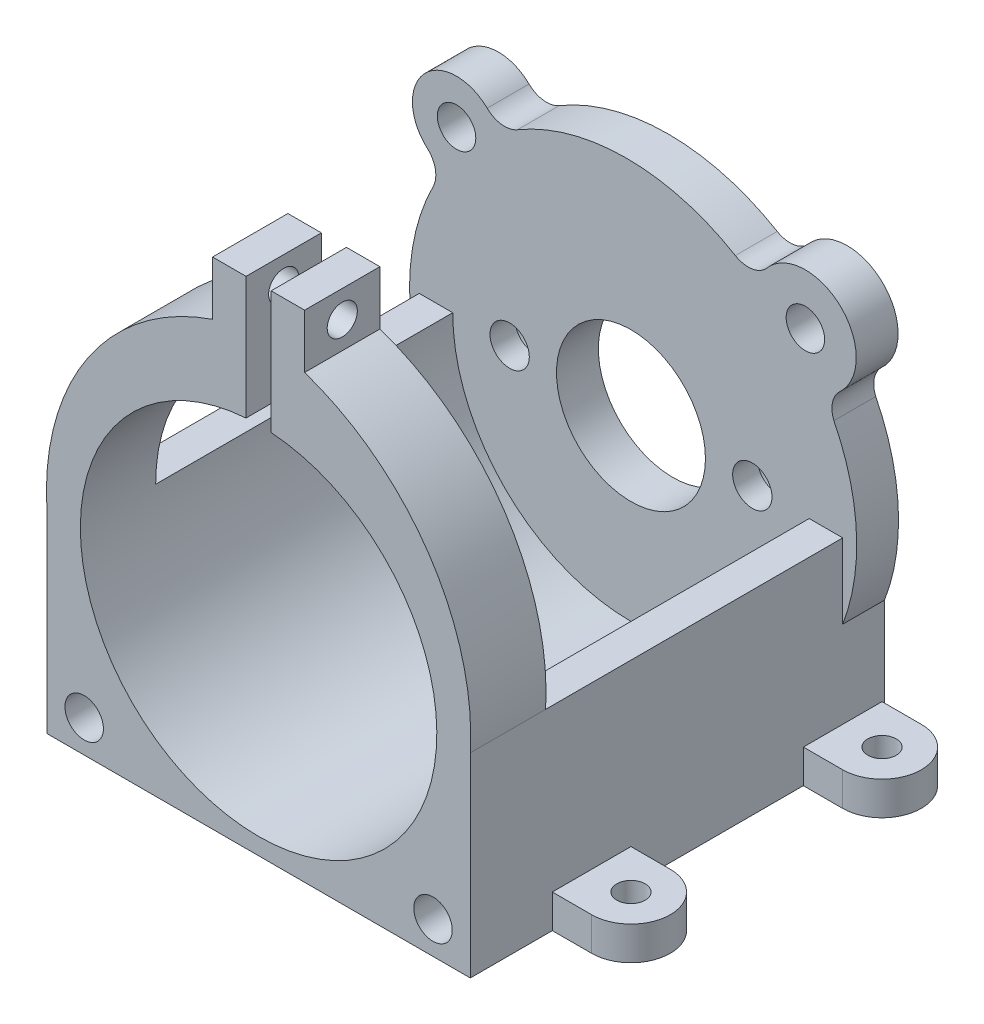
from build123d import *
from build123d.topology import SkipClean

# Parameters (mm, degrees)
SKETCH_1_R               = 2.35
SKETCH_1_R_2             = 8.9
EXTRUDE_1_DEPTH          = 5
EXTRUDE_2_DEPTH          = 44.5
EXTRUDE_2_DEPTH_BACK     = 5
EXTRUDE_START            = -9
EXTRUDE_3_DEPTH          = 9
SKETCH_5_R               = 1.8
CUT_EXTRUDE_2_DEPTH      = 19
CUT_EXTRUDE_5_DEPTH      = 10
CUT_EXTRUDE_5_DEPTH_BACK = 10
SKETCH_9_W               = 118.709111843
SKETCH_9_H               = 68.105929764
SKETCH_9_W_2             = 50.6
SKETCH_9_H_2             = 49.5
SKETCH_10_W              = 50.6
SKETCH_10_H              = 4.95
CUT_EXTRUDE_6_DEPTH      = 67.841008738
SKETCH_11_R              = 2.3
CUT_EXTRUDE_7_DEPTH      = 67.841008738
SKETCH_12_R              = 2.3
CUT_EXTRUDE_8_DEPTH      = 10
SKETCH_13_R              = 4.5
CUT_EXTRUDE_9_DEPTH      = 2
SKETCH_14_R              = 1.7
EXTRUDE_4_DEPTH          = 4


with BuildPart() as part:
    # Эскиз1 → Бобышка-Вытянуть1 (new body)
    with BuildSketch(Plane.XY):
        with BuildLine():
            ThreePointArc((-13.750457514, -22.60807726), (-15.630598029, -22.207924557), (-17.367665677, -23.031117444))
            ThreePointArc((-17.367665677, -23.031117444), (-24.500349004, -22.846945062), (-24.186521915, -15.718789377))
            ThreePointArc((-24.186521915, -15.718789377), (-23.24416257, -14.043376172), (-23.512188549, -12.139902343))
            ThreePointArc((-23.512188549, -12.139902343), (-26.460924905, -0.14032965), (-23.639624978, 11.889843151))
            ThreePointArc((-23.639624978, 11.889843151), (-23.371598999, 13.79331698), (-24.313958344, 15.468730186))
            ThreePointArc((-24.313958344, 15.468730186), (-24.723627875, 23.005643376), (-17.178817704, 23.226389957))
            ThreePointArc((-17.178817704, 23.226389957), (-15.441750056, 22.403197069), (-13.561609541, 22.803349773))
            ThreePointArc((-13.561609541, 22.803349773), (-0.542505729, 26.377270873), (12.476598084, 22.803349773))
            ThreePointArc((12.476598084, 22.803349773), (14.356738599, 22.403197069), (16.093806247, 23.226389957))
            ThreePointArc((16.093806247, 23.226389957), (25.011719512, 23.858129918), (24.906055495, 14.918493041))
            ThreePointArc((24.906055495, 14.918493041), (24.067269609, 13.359986921), (24.253003064, 11.599871535))
            ThreePointArc((24.253003064, 11.599871535), (26.972168217, 0.141967553), (24.253003064, -11.31593643))
            ThreePointArc((24.253003064, -11.31593643), (23.984977085, -13.219410259), (24.92733643, -14.894823465))
            ThreePointArc((24.92733643, -14.894823465), (24.934120683, -23.972974271), (15.904958274, -23.031117444))
            ThreePointArc((15.904958274, -23.031117444), (14.167890626, -22.207924557), (12.287750111, -22.60807726))
            ThreePointArc((12.287750111, -22.60807726), (-0.731353702, -26.18199836), (-13.750457514, -22.60807726))
        make_face()
        with Locations((-14.5, 0)):
            Circle(SKETCH_1_R, mode=Mode.SUBTRACT)
        with Locations((14.5, 0)):
            Circle(SKETCH_1_R, mode=Mode.SUBTRACT)
        Circle(SKETCH_1_R_2, mode=Mode.SUBTRACT)
    extrude(amount=EXTRUDE_1_DEPTH)

    # Эскиз2 → Бобышка-Вытянуть2 (add, two sides: drawn at the far end of the back side and taken through both)
    with BuildSketch(Plane.XY.offset(5).offset(-EXTRUDE_2_DEPTH_BACK)):
        with BuildLine():
            Line((-25.3, 0), (-21.3, 0))
            ThreePointArc((-21.3, 0), (0, -21.3), (21.3, 0))
            Line((21.3, 0), (25.3, 0))
            Line((25.3, 0), (25.3, -13.25))
            ThreePointArc((25.3, -13.25), (28.228932188, -20.321067812), (35.3, -23.25))
            Line((35.3, -23.25), (50, -23.25))
            Line((50, -23.25), (50, -28.25))
            Line((50, -28.25), (-50, -28.25))
            Line((-50, -28.25), (-50, -23.25))
            Line((-50, -23.25), (-35.3, -23.25))
            ThreePointArc((-35.3, -23.25), (-28.228932188, -20.321067812), (-25.3, -13.25))
            Line((-25.3, -13.25), (-25.3, 0))
        make_face()
    extrude(amount=EXTRUDE_2_DEPTH + EXTRUDE_2_DEPTH_BACK)

    # Эскиз4 → Бобышка-Вытянуть3 (add)
    with SkipClean():  # the faces are left unmerged after this step: merging them gives an invalid solid
        with BuildSketch(Plane.XY.offset(49.5).offset(EXTRUDE_START)):
            with BuildLine():
                Line((21.3, 0), (25.3, 0))
                ThreePointArc((25.3, 0), (20.373090978, 18.07450089), (5.5, 29.465426213))
                Line((5.5, 29.465426213), (5.5, 35.916188423))
                Line((5.5, 35.916188423), (1.5, 35.916188423))
                Line((1.5, 35.916188423), (1.5, 29.916188423))
                Line((1.5, 29.916188423), (1.5, 21.247117452))
                ThreePointArc((1.5, 21.247117452), (15.582682696, 14.521363572), (21.3, 0))
            make_face()
            with BuildLine():
                Line((-25.3, 0), (-21.3, 0))
                ThreePointArc((-21.3, 0), (-15.582682696, 14.521363572), (-1.5, 21.247117452))
                Line((-1.5, 21.247117452), (-1.5, 29.916188423))
                Line((-1.5, 29.916188423), (-1.5, 35.916188423))
                Line((-1.5, 35.916188423), (-5.5, 35.916188423))
                Line((-5.5, 35.916188423), (-5.5, 29.465426213))
                ThreePointArc((-5.5, 29.465426213), (-20.373090978, 18.07450089), (-25.3, 0))
            make_face()
        extrude(amount=EXTRUDE_3_DEPTH)

    # Эскиз5 → Вырез-Вытянуть2 (cut)
    with SkipClean():  # the faces are left unmerged after this step: merging them gives an invalid solid
        with BuildSketch(Plane.ZY.offset(5.5)):
            with Locations((45, 32.690807318)):
                Circle(SKETCH_5_R)
        extrude(amount=-CUT_EXTRUDE_2_DEPTH, mode=Mode.SUBTRACT)

    # Эскиз9 → Вырез-Вытянуть5 (cut, two sides: drawn at the far end of the back side and taken through both)
    with SkipClean():  # the faces are left unmerged after this step: merging them gives an invalid solid
        with BuildSketch(Plane(origin=(0, -23.25, 0), x_dir=(1, 0, 0), z_dir=(0, 1, 0)).offset(-CUT_EXTRUDE_5_DEPTH_BACK)):
            with Locations((-0.535798399, -23.678403203)):
                Rectangle(SKETCH_9_W, SKETCH_9_H)
            with Locations((0, -24.75)):
                Rectangle(SKETCH_9_W_2, SKETCH_9_H_2, mode=Mode.SUBTRACT)
        extrude(amount=CUT_EXTRUDE_5_DEPTH + CUT_EXTRUDE_5_DEPTH_BACK, mode=Mode.SUBTRACT)

    # Эскиз10 → Вырез-Вытянуть6 (cut, through all)
    with SkipClean():  # the faces are left unmerged after this step: merging them gives an invalid solid
        with BuildSketch(Plane.XY.offset(49.5)):
            with Locations((0, -25.775)):
                Rectangle(SKETCH_10_W, SKETCH_10_H)
        extrude(amount=-CUT_EXTRUDE_6_DEPTH, mode=Mode.SUBTRACT)

    # Эскиз11 → Вырез-Вытянуть7 (cut, through all)
    with SkipClean():  # the faces are left unmerged after this step: merging them gives an invalid solid
        with BuildSketch(Plane(origin=(0, 0, 0), x_dir=(-1, 0, 0), z_dir=(0, 0, -1))):
            with Locations((-20.843580496, -19.436953262)):
                Circle(SKETCH_11_R)
            with Locations((20.843580496, -19.436953262)):
                Circle(SKETCH_11_R)
        extrude(amount=-CUT_EXTRUDE_7_DEPTH, mode=Mode.SUBTRACT)

    # Эскиз12 → Вырез-Вытянуть8 (cut)
    with SkipClean():  # the faces are left unmerged after this step: merging them gives an invalid solid
        with BuildSketch(Plane(origin=(0, 0, 0), x_dir=(-1, 0, 0), z_dir=(0, 0, -1))):
            with Locations((-20.843580496, 19.436953262)):
                Circle(SKETCH_12_R)
            with Locations((20.843580496, 19.436953262)):
                Circle(SKETCH_12_R)
        extrude(amount=-CUT_EXTRUDE_8_DEPTH, mode=Mode.SUBTRACT)

    # Эскиз13 → Вырез-Вытянуть9 (cut)
    with SkipClean():  # the faces are left unmerged after this step: merging them gives an invalid solid
        with BuildSketch(Plane(origin=(0, 0, 0), x_dir=(-1, 0, 0), z_dir=(0, 0, -1))):
            with Locations((-14.5, 0)):
                Circle(SKETCH_13_R)
            with Locations((14.5, 0)):
                Circle(SKETCH_13_R)
        extrude(amount=-CUT_EXTRUDE_9_DEPTH, mode=Mode.SUBTRACT)

    # Эскиз14 → Бобышка-Вытянуть4 (add)
    # profile 1 of 4: a face of its own
    with SkipClean():  # the faces are left unmerged after this step: merging them gives an invalid solid
        with BuildSketch(Plane.XZ.offset(23.3)):
            with BuildLine():
                Line((-30, 39.7), (-25.3, 39.7))
                Line((-25.3, 39.7), (-25.3, 30.3))
                Line((-25.3, 30.3), (-30, 30.3))
                ThreePointArc((-30, 30.3), (-34.7, 35), (-30, 39.7))
            make_face()
            with Locations((-30, 35)):
                Circle(SKETCH_14_R, mode=Mode.SUBTRACT)
        # profile 2 of 4: a face of its own
        with BuildSketch(Plane.XZ.offset(23.3)):
            with BuildLine():
                Line((25.3, 39.7), (25.3, 30.3))
                Line((25.3, 30.3), (30, 30.3))
                ThreePointArc((30, 30.3), (34.7, 35), (30, 39.7))
                Line((30, 39.7), (25.3, 39.7))
            make_face()
            with Locations((30, 35)):
                Circle(SKETCH_14_R, mode=Mode.SUBTRACT)
        # profile 3 of 4: a face of its own
        with BuildSketch(Plane.XZ.offset(23.3)):
            with BuildLine():
                Line((30, 0.3), (25.3, 0.3))
                Line((25.3, 0.3), (25.3, 9.7))
                Line((25.3, 9.7), (30, 9.7))
                ThreePointArc((30, 9.7), (34.7, 5), (30, 0.3))
            make_face()
            with Locations((30, 5)):
                Circle(SKETCH_14_R, mode=Mode.SUBTRACT)
        # profile 4 of 4: a face of its own
        with BuildSketch(Plane.XZ.offset(23.3)):
            with BuildLine():
                Line((-25.3, 0.3), (-25.3, 9.7))
                Line((-25.3, 9.7), (-30, 9.7))
                ThreePointArc((-30, 9.7), (-34.7, 5), (-30, 0.3))
                Line((-30, 0.3), (-25.3, 0.3))
            make_face()
            with Locations((-30, 5)):
                Circle(SKETCH_14_R, mode=Mode.SUBTRACT)
        extrude(amount=-EXTRUDE_4_DEPTH)


solid = part.part
